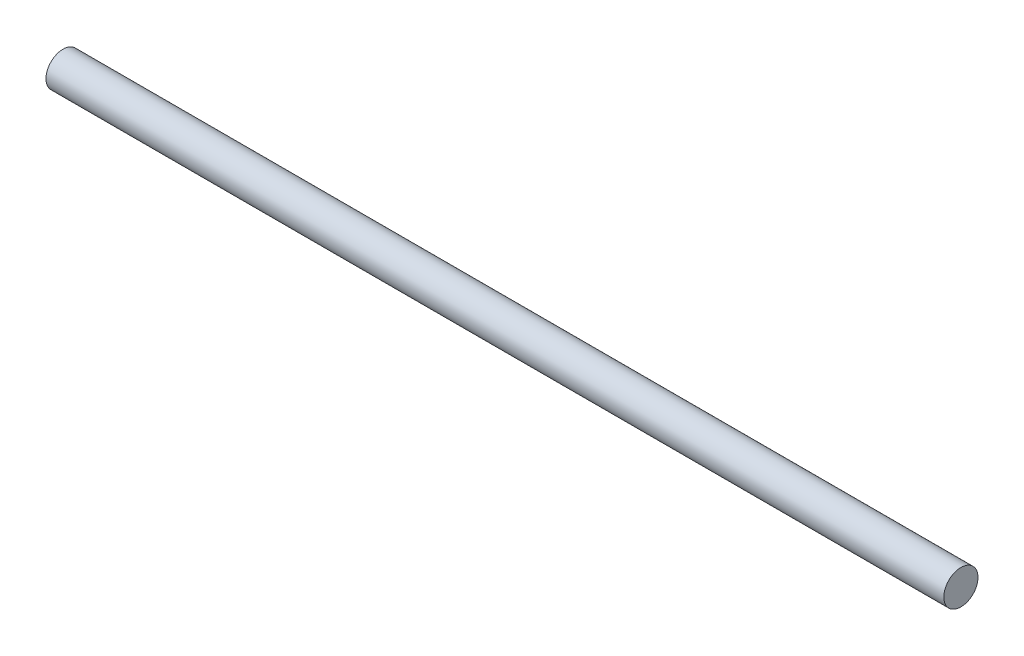
from build123d import *

# Parameters (mm, degrees)
SKETCH_1_R      = 4
EXTRUDE_1_DEPTH = 210


with BuildPart() as part:
    # 草图1 → 凸台-拉伸1 (new body)
    with BuildSketch(Plane(origin=(0, 0, 0), x_dir=(0, 0, -1), z_dir=(1, 0, 0))):
        with Locations((-8.754966743, 16.652729458)):
            Circle(SKETCH_1_R)
    extrude(amount=EXTRUDE_1_DEPTH)


solid = part.part
